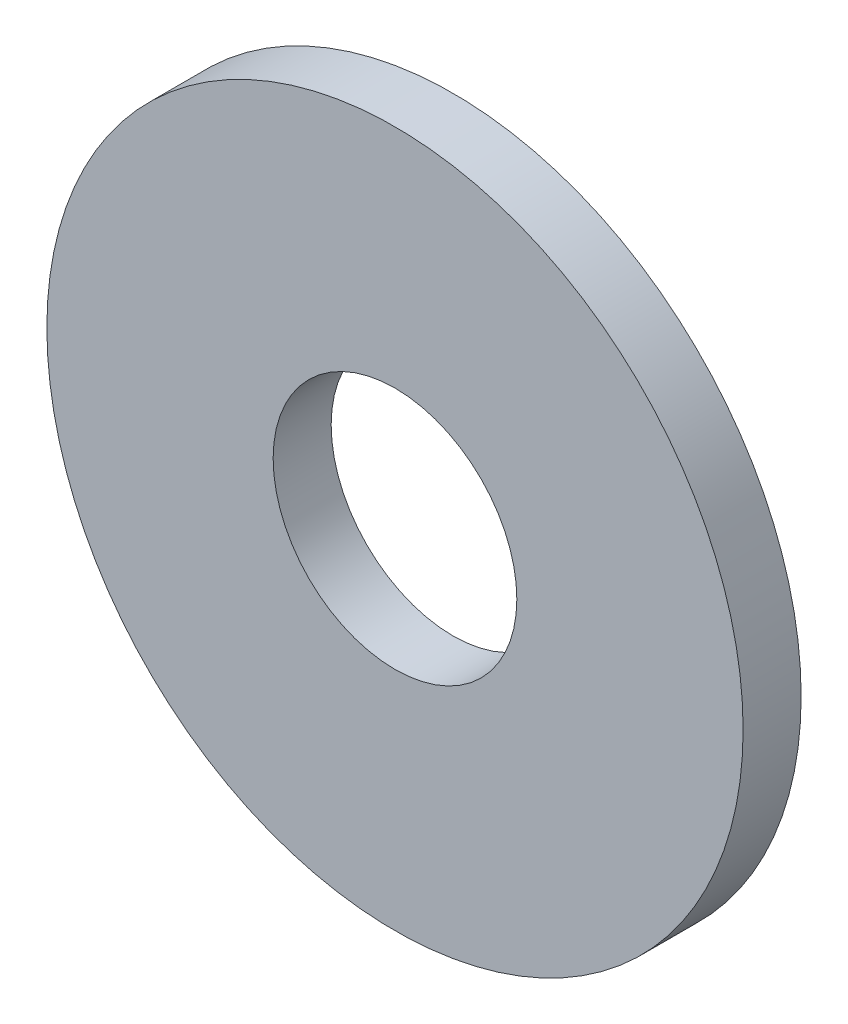
from build123d import *

# Parameters (mm, degrees)
SKETCH1_R           = 12
SKETCH1_R_2         = 4.2
BOSS_EXTRUDE1_DEPTH = 2


with BuildPart() as part:
    # Sketch1 → Boss-Extrude1 (new body)
    with BuildSketch(Plane.XY):
        Circle(SKETCH1_R)
        Circle(SKETCH1_R_2, mode=Mode.SUBTRACT)
    extrude(amount=BOSS_EXTRUDE1_DEPTH)


solid = part.part
